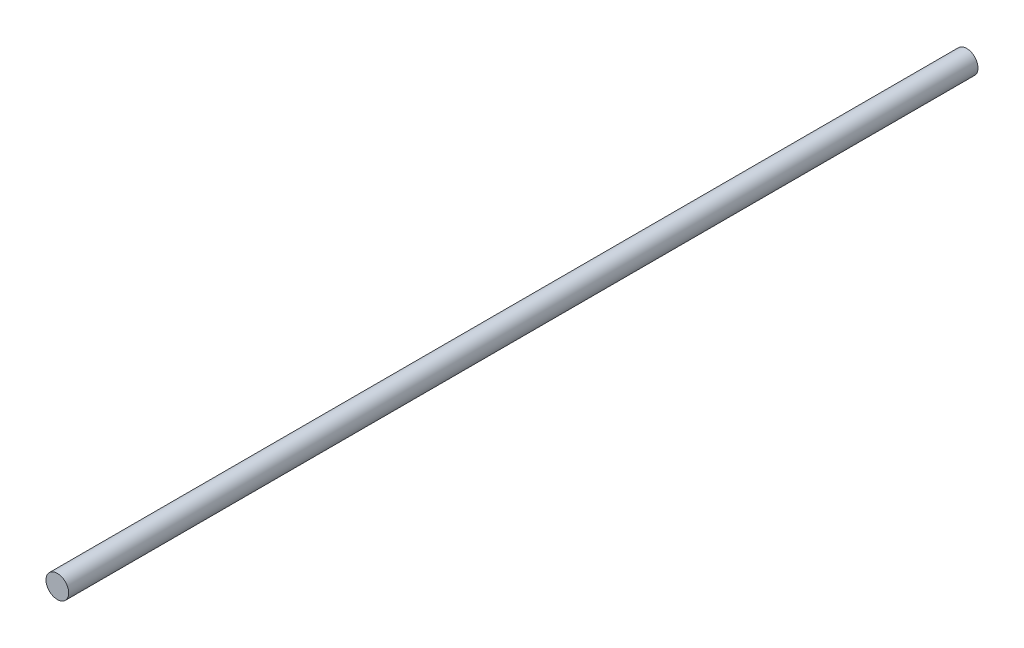
from build123d import *

# Parameters (mm, degrees)
ESQUISSE1_R        = 3
BOSS_EXTRU_1_DEPTH = 240


with BuildPart() as part:
    # Esquisse1 → Boss.-Extru.1 (new body)
    with BuildSketch(Plane.XY):
        Circle(ESQUISSE1_R)
    extrude(amount=BOSS_EXTRU_1_DEPTH)


solid = part.part
